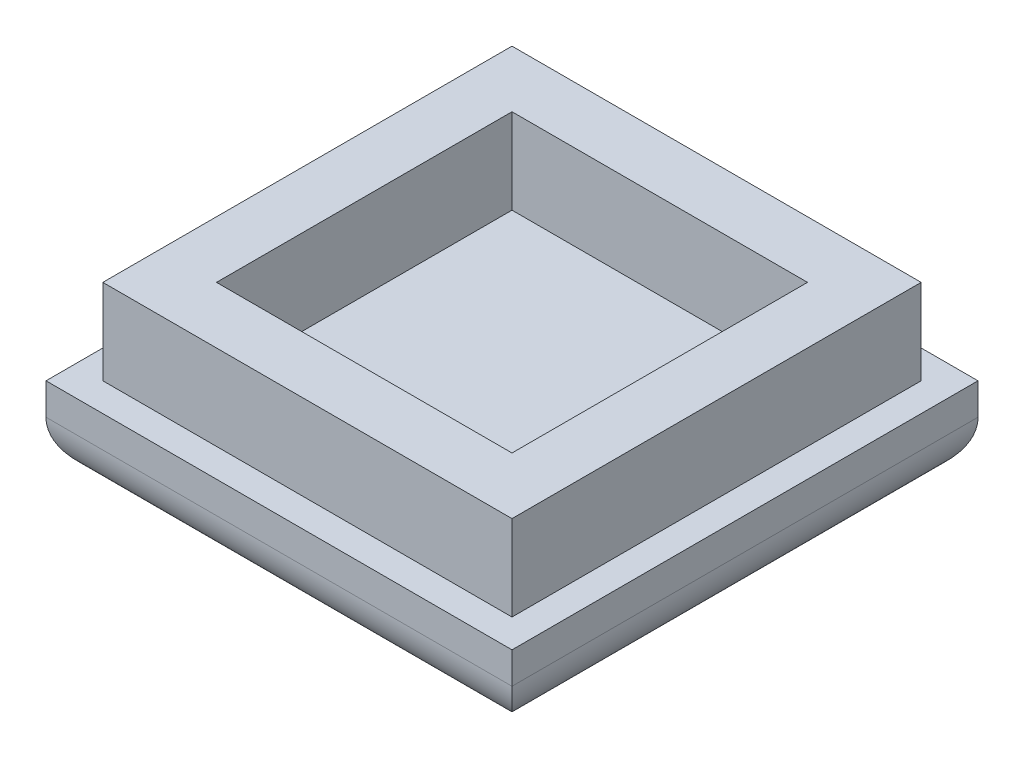
from build123d import *

# Parameters (mm, degrees)
SKETCH1_W                = 22.86
SKETCH1_H                = 22.86
SKETCH1_W_2              = 16.51
SKETCH1_H_2              = 16.51
BOSS_EXTRUDE1_DEPTH      = 6.35
BOSS_EXTRUDE2_DEPTH      = 1.5875
BOSS_EXTRUDE2_DEPTH_BACK = 3.175
SKETCH1_3_W              = 26.035
SKETCH1_3_H              = 26.035
FILLET1_R                = 3
CUT_EXTRUDE1_DEPTH       = 1


with BuildPart() as part:
    # Sketch1 → Boss-Extrude1 (new body)
    with BuildSketch(Plane(origin=(0, 0, 0), x_dir=(1, 0, 0), z_dir=(0, 1, 0))):
        with Locations((-52.595020858, 17.564583421)):
            Rectangle(SKETCH1_W, SKETCH1_H)
        with Locations((-52.595020858, 17.564583421)):
            Rectangle(SKETCH1_W_2, SKETCH1_H_2, mode=Mode.SUBTRACT)
    extrude(amount=BOSS_EXTRUDE1_DEPTH)

    # Sketch1<3> → Boss-Extrude2 (add, two sides: drawn at the far end of the back side and taken through both)
    with BuildSketch(Plane(origin=(0, 0, 0), x_dir=(1, 0, 0), z_dir=(0, 1, 0)).offset(-BOSS_EXTRUDE2_DEPTH_BACK)):
        with Locations((-52.595020858, 17.564583421)):
            Rectangle(SKETCH1_3_W, SKETCH1_3_H)
    extrude(amount=BOSS_EXTRUDE2_DEPTH + BOSS_EXTRUDE2_DEPTH_BACK)

    # Fillet1
    fillet1_edges = [part.edges().sort_by_distance(p)[0] for p in [
        (-52.595020858, -3.175, -30.582083421),
        (-39.577520858, -3.175, -17.564583421),
        (-52.595020858, -3.175, -4.547083421),
        (-65.612520858, -3.175, -17.564583421),
    ]]
    fillet(fillet1_edges, radius=FILLET1_R)

    # Sketch2 → Cut-Extrude1 (cut)
    # profile 1 of 11: a face of its own
    with BuildSketch(Plane(origin=(0, -3.175, 0), x_dir=(-1, 0, 0), z_dir=(0, -1, 0))):
        Polygon((58.842157984, 26.640147671), (59.271218345, 27.069208032), (61.751201751, 24.589224626), (61.32214139, 24.160164265), (60.266551264, 25.215754391), (59.778685676, 24.727888803), (60.834275802, 23.672298677), (60.396503556, 23.23452643), (57.91652015, 25.714509836), (58.354292396, 26.152282083), (59.422950351, 25.083624128), (59.910815939, 25.571489716), align=None)
    # profile 2 of 11: a face of its own
    with BuildSketch(Plane(origin=(0, -3.175, 0), x_dir=(-1, 0, 0), z_dir=(0, -1, 0))):
        with BuildLine():
            Line((59.665433681, 22.503456555), (57.759708727, 24.409181508))
            add(Edge.make_bspline(
                [(57.759708727, 24.409181508), (57.738522026, 24.429251315), (57.699131078, 24.466565698), (57.635567911, 24.508369583), (57.573636035, 24.532874055), (57.513228744, 24.538097721), (57.455910348, 24.527659249), (57.400357879, 24.506176439), (57.346724247, 24.471974802), (57.314698871, 24.442167384), (57.297978796, 24.426605279)],
                knots=[0, 0, 0, 0, 1.316322234, 2.447345534, 3.41587546, 4.293733729, 5.147368164, 6.026382719, 6.969597433, 8, 8, 8, 8], degree=3))
            add(Edge.make_bspline(
                [(57.297978796, 24.426605279), (57.282321332, 24.409938788), (57.25241913, 24.378109571), (57.219460584, 24.323829793), (57.196668497, 24.268865963), (57.1866132, 24.211349206), (57.191465978, 24.150773626), (57.217279431, 24.08940919), (57.257797996, 24.025185013), (57.295224163, 23.986001324), (57.315402567, 23.964875348)],
                knots=[0, 0, 0, 0, 1.030889829, 1.968765676, 2.852199039, 3.706237146, 4.584510541, 5.557378995, 6.683055297, 8, 8, 8, 8], degree=3))
            Line((57.315402567, 23.964875348), (59.22112752, 22.059150394))
            Line((59.22112752, 22.059150394), (58.815298854, 21.653321728))
            Line((58.815298854, 21.653321728), (56.934983567, 23.533637016))
            add(Edge.make_bspline(
                [(56.934983567, 23.533637016), (56.911160792, 23.558483674), (56.864943864, 23.606686969), (56.803204477, 23.682376935), (56.752390007, 23.759878777), (56.709970234, 23.837418548), (56.676653613, 23.9158474), (56.653460368, 23.995053017), (56.639299961, 24.075165003), (56.635108957, 24.155823257), (56.639877884, 24.236817258), (56.655838155, 24.317560768), (56.680341386, 24.398312038), (56.71559204, 24.478618238), (56.761491, 24.558041911), (56.815845463, 24.63782822), (56.880124708, 24.717537318), (56.928766057, 24.767949596), (56.953859319, 24.793956451)],
                knots=[0, 0, 0, 0, 1.14727371, 2.225746903, 3.250503492, 4.232351556, 5.168772348, 6.085207589, 6.977791315, 7.874557658, 8.771795591, 9.675213844, 10.611738878, 11.579937216, 12.591558839, 13.665587569, 14.795715502, 16, 16, 16, 16], degree=3))
            add(Edge.make_bspline(
                [(56.953859319, 24.793956451), (56.979867703, 24.819049546), (57.030527961, 24.867926964), (57.11035543, 24.93226413), (57.190014187, 24.987410165), (57.269603463, 25.032988703), (57.350537126, 25.067101558), (57.430820983, 25.092964038), (57.51174788, 25.108592104), (57.59271226, 25.113451969), (57.67337842, 25.109236696), (57.753488286, 25.095082796), (57.832694487, 25.071887758), (57.911123176, 25.038571637), (57.988662994, 24.996151721), (58.066164823, 24.945337292), (58.141854792, 24.883597894), (58.190058087, 24.837380967), (58.214904745, 24.813558194)],
                knots=[0, 0, 0, 0, 1.203464209, 2.344159745, 3.410805776, 4.428753563, 5.393096494, 6.331376355, 7.234179251, 8.130806038, 9.026961555, 9.918937304, 10.834748322, 11.770531278, 12.751710564, 13.775769147, 14.853507747, 16, 16, 16, 16], degree=3))
            Line((58.214904745, 24.813558194), (60.095220032, 22.933242906))
            Line((60.095220032, 22.933242906), (59.665433681, 22.503456555))
        make_face()
    # profile 3 of 11: a face of its own
    with BuildSketch(Plane(origin=(0, -3.175, 0), x_dir=(-1, 0, 0), z_dir=(0, -1, 0))):
        with BuildLine():
            Line((56.801417876, 21.811604202), (56.200297777, 21.210484103))
            Line((56.200297777, 21.210484103), (55.411146149, 21.999635731))
            add(Edge.make_bspline(
                [(55.411146149, 21.999635731), (55.387279592, 22.024448595), (55.340611027, 22.072967566), (55.279105598, 22.149683326), (55.226941523, 22.227425926), (55.183770034, 22.30541725), (55.151067367, 22.384721367), (55.126283916, 22.464025644), (55.112980238, 22.544611167), (55.107261516, 22.625429146), (55.112811338, 22.706589857), (55.127252939, 22.787783753), (55.152323061, 22.868868402), (55.187535663, 22.949446662), (55.232007469, 23.029850176), (55.287437984, 23.109224557), (55.351673648, 23.189106049), (55.400565469, 23.239758642), (55.425665958, 23.265763091)],
                knots=[0, 0, 0, 0, 1.142074728, 2.233208173, 3.257768271, 4.246059396, 5.185644489, 6.100221424, 6.99667273, 7.889844743, 8.783016756, 9.688772054, 10.621053134, 11.592229698, 12.602336328, 13.664872487, 14.801172834, 16, 16, 16, 16], degree=3))
            add(Edge.make_bspline(
                [(55.425665958, 23.265763091), (55.451672812, 23.290856352), (55.502085091, 23.339497701), (55.58179419, 23.403776947), (55.661580496, 23.458131402), (55.74100418, 23.504030391), (55.821310342, 23.539280947), (55.902061744, 23.563784524), (55.982804781, 23.57974356), (56.063800521, 23.584517032), (56.144452307, 23.580309118), (56.224588537, 23.566212088), (56.303611474, 23.542801089), (56.382322813, 23.510484415), (56.459910882, 23.46828699), (56.536159097, 23.415759718), (56.613147021, 23.356008996), (56.660781243, 23.309344614), (56.685259403, 23.285364833)],
                knots=[0, 0, 0, 0, 1.205033327, 2.335863978, 3.410560543, 4.422811197, 5.391611565, 6.328718934, 7.232698936, 8.130494776, 9.027818731, 9.92095747, 10.837962553, 11.771865889, 12.75432447, 13.777491696, 14.857902762, 16, 16, 16, 16], degree=3))
            Line((56.685259403, 23.285364833), (57.967358553, 22.003265683))
            add(Edge.make_bspline(
                [(57.967358553, 22.003265683), (57.991338333, 21.978787523), (58.038002716, 21.931153301), (58.097753437, 21.854165377), (58.15028071, 21.777917162), (58.192478134, 21.700329093), (58.224794808, 21.621617754), (58.248205808, 21.542594817), (58.262302838, 21.462458588), (58.266510751, 21.381806801), (58.261737279, 21.300811062), (58.245778244, 21.220068024), (58.221274667, 21.139316623), (58.18602411, 21.05901046), (58.140125122, 20.979586776), (58.085770667, 20.89980047), (58.02149142, 20.820091371), (57.972850072, 20.769679093), (57.94775681, 20.743672238)],
                knots=[0, 0, 0, 0, 1.142097238, 2.222508304, 3.24567553, 4.228134111, 5.162037447, 6.07904253, 6.972181269, 7.869505224, 8.767301064, 9.671281066, 10.608388435, 11.577188803, 12.589439457, 13.664136022, 14.794966673, 16, 16, 16, 16], degree=3))
            add(Edge.make_bspline(
                [(57.94775681, 20.743672238), (57.921705343, 20.718633505), (57.871096588, 20.669992133), (57.791865771, 20.60488549), (57.71183515, 20.55057381), (57.632266698, 20.504757102), (57.552336334, 20.468943057), (57.471791448, 20.443013954), (57.391024115, 20.427901354), (57.310421843, 20.42198729), (57.230369542, 20.425260005), (57.151133793, 20.439846229), (57.072392271, 20.46220141), (56.994469711, 20.494366123), (56.917673827, 20.53649175), (56.841721812, 20.587339956), (56.766023127, 20.647389191), (56.718520131, 20.693157967), (56.693971289, 20.716810591)],
                knots=[0, 0, 0, 0, 1.21022765, 2.351042799, 3.430371867, 4.44698585, 5.423232885, 6.359057276, 7.27489836, 8.169024841, 9.061716805, 9.950719944, 10.861631989, 11.799560936, 12.7681367, 13.79119521, 14.858522515, 16, 16, 16, 16], degree=3))
            Line((56.693971289, 20.716810591), (56.456572409, 20.954209471))
            Line((56.456572409, 20.954209471), (56.862401075, 21.360038137))
            Line((56.862401075, 21.360038137), (57.120127688, 21.102311524))
            add(Edge.make_bspline(
                [(57.120127688, 21.102311524), (57.141083072, 21.082721759), (57.179870226, 21.046462281), (57.242752236, 21.005843366), (57.304020253, 20.981496381), (57.364412105, 20.97634534), (57.422130978, 20.986635523), (57.477468303, 21.009066667), (57.531900942, 21.042257496), (57.563736058, 21.072142997), (57.580405638, 21.087791715)],
                knots=[0, 0, 0, 0, 1.300892313, 2.407873352, 3.381818771, 4.264585546, 5.122993041, 6.02116182, 6.963835982, 8, 8, 8, 8], degree=3))
            add(Edge.make_bspline(
                [(57.580405638, 21.087791715), (57.595757859, 21.104504601), (57.625174809, 21.136528771), (57.658361203, 21.190390197), (57.68034951, 21.245836434), (57.689672846, 21.303909877), (57.683588605, 21.364818024), (57.659355428, 21.42753634), (57.617680959, 21.491764322), (57.580175094, 21.53126143), (57.560077905, 21.552425609)],
                knots=[0, 0, 0, 0, 1.019744547, 1.953969752, 2.829976834, 3.689710769, 4.576423019, 5.551852122, 6.688181448, 8, 8, 8, 8], degree=3))
            Line((57.560077905, 21.552425609), (56.230789376, 22.881714138))
            add(Edge.make_bspline(
                [(56.230789376, 22.881714138), (56.209651621, 22.901861382), (56.170446084, 22.939229754), (56.106434151, 22.980070723), (56.044730389, 23.00473247), (55.984329256, 23.009834491), (55.926811959, 22.999679079), (55.871954625, 22.977130937), (55.818200304, 22.943715029), (55.786475847, 22.914029591), (55.769785435, 22.898411919)],
                knots=[0, 0, 0, 0, 1.319116741, 2.446649622, 3.417235704, 4.296957636, 5.152404308, 6.037294719, 6.967409923, 8, 8, 8, 8], degree=3))
            add(Edge.make_bspline(
                [(55.769785435, 22.898411919), (55.754137648, 22.881742525), (55.724253924, 22.849907766), (55.691050873, 22.795472673), (55.668572597, 22.73992172), (55.658153423, 22.681889848), (55.664401174, 22.620989731), (55.689592951, 22.558847894), (55.731165684, 22.494117), (55.76900283, 22.454431931), (55.789387177, 22.433052035)],
                knots=[0, 0, 0, 0, 1.022870966, 1.953451467, 2.84009755, 3.698194483, 4.570649028, 5.546082863, 6.677979014, 8, 8, 8, 8], degree=3))
            Line((55.789387177, 22.433052035), (56.250391118, 21.972048094))
            Line((56.250391118, 21.972048094), (56.445682552, 22.167339527))
            Line((56.445682552, 22.167339527), (56.801417876, 21.811604202))
        make_face()
    # profile 4 of 11: a face of its own
    with BuildSketch(Plane(origin=(0, -3.175, 0), x_dir=(-1, 0, 0), z_dir=(0, -1, 0))):
        with BuildLine():
            add(Edge.make_bspline(
                [(56.475649722, 20.511556853), (56.499621828, 20.487074409), (56.546271274, 20.439431851), (56.606127519, 20.362502821), (56.658229776, 20.286126476), (56.701732882, 20.209271122), (56.734162705, 20.131031354), (56.758923083, 20.052696566), (56.773310377, 19.973438458), (56.77857668, 19.893755108), (56.773936917, 19.813865467), (56.760589995, 19.733670683), (56.734966361, 19.654100144), (56.700599725, 19.574269502), (56.656080475, 19.494679094), (56.601884106, 19.414847547), (56.536987098, 19.335885367), (56.488346314, 19.285275402), (56.463307884, 19.259223312)],
                knots=[0, 0, 0, 0, 1.147548425, 2.233116251, 3.261167015, 4.245110883, 5.186586225, 6.094772243, 6.993602212, 7.879494458, 8.764903899, 9.670296887, 10.596379033, 11.559134903, 12.579316873, 13.647874652, 14.789215095, 16, 16, 16, 16], degree=3))
            add(Edge.make_bspline(
                [(56.463307884, 19.259223312), (56.437316322, 19.234105098), (56.386933688, 19.185415382), (56.307172225, 19.121601046), (56.228483919, 19.066292727), (56.148386039, 19.022962631), (56.069328516, 18.986873993), (55.989028884, 18.963433986), (55.909043489, 18.948133234), (55.828993903, 18.944069022), (55.749099211, 18.949185432), (55.669832867, 18.96361775), (55.591500335, 18.988365795), (55.513259933, 19.020799083), (55.43640476, 19.0643012), (55.360028363, 19.11640374), (55.283099348, 19.176259904), (55.235456788, 19.222909362), (55.210974343, 19.246881474)],
                knots=[0, 0, 0, 0, 1.210890748, 2.347218136, 3.420446406, 4.429694985, 5.395775476, 6.327322056, 7.226230598, 8.119816741, 9.005786429, 9.904694971, 10.812960379, 11.754518023, 12.738547904, 13.766688536, 14.85235126, 16, 16, 16, 16], degree=3))
            Line((55.210974343, 19.246881474), (55.133293364, 19.324562453))
            Line((55.133293364, 19.324562453), (55.539848021, 19.73111711))
            Line((55.539848021, 19.73111711), (55.640760695, 19.630204436))
            add(Edge.make_bspline(
                [(55.640760695, 19.630204436), (55.661968984, 19.610148503), (55.701104887, 19.573139057), (55.764044716, 19.531297673), (55.824119631, 19.504602451), (55.883320466, 19.496962019), (55.939635883, 19.505091657), (55.99444326, 19.525079556), (56.04726104, 19.558921071), (56.079205879, 19.588062154), (56.095956712, 19.603342789)],
                knots=[0, 0, 0, 0, 1.333215265, 2.460197613, 3.443029833, 4.313694693, 5.151424605, 6.02356654, 6.963622678, 8, 8, 8, 8], degree=3))
            add(Edge.make_bspline(
                [(56.095956712, 19.603342789), (56.111237686, 19.620093496), (56.140379416, 19.652038096), (56.174216529, 19.704857507), (56.194302321, 19.759886297), (56.202338876, 19.816480447), (56.194580487, 19.876085093), (56.168118061, 19.936893994), (56.125550402, 20.000057656), (56.088384811, 20.039483675), (56.068369075, 20.060716778)],
                knots=[0, 0, 0, 0, 1.031663454, 1.967443832, 2.835618909, 3.680464448, 4.547169169, 5.535721002, 6.672848743, 8, 8, 8, 8], degree=3))
            add(Edge.make_bspline(
                [(56.068369075, 20.060716778), (56.047181831, 20.080816127), (56.005790905, 20.120081766), (55.934716156, 20.165519503), (55.8610311, 20.201764068), (55.782220956, 20.223222107), (55.701158982, 20.237273072), (55.61752646, 20.246991034), (55.531155263, 20.250382357), (55.411713041, 20.247687112), (55.257658646, 20.238159421), (55.068861861, 20.218915292), (54.8756364, 20.203303975), (54.712706791, 20.203239627), (54.582582737, 20.213449727), (54.485123454, 20.228447664), (54.388413224, 20.252565475), (54.291212003, 20.281269174), (54.195313423, 20.322137432), (54.101763489, 20.376811121), (54.009713496, 20.444191244), (53.953441795, 20.498277429), (53.924519251, 20.526076662)],
                knots=[0, 0, 0, 0, 0.766999624, 1.498393328, 2.210677015, 2.920249948, 3.638658968, 4.375826668, 5.134476084, 5.911669889, 7.519646407, 9.19546478, 10.906798196, 12.62022845, 13.476623857, 14.34056599, 15.211896375, 16.098390702, 17.005849835, 17.947601136, 18.945107461, 20, 20, 20, 20], degree=3))
            add(Edge.make_bspline(
                [(53.924519251, 20.526076662), (53.900531939, 20.550550941), (53.853852902, 20.598177611), (53.79420572, 20.675218893), (53.741379789, 20.751185268), (53.700447178, 20.829399031), (53.667016447, 20.907324895), (53.643495605, 20.986482766), (53.62976639, 21.066407581), (53.625061733, 21.14708669), (53.631234154, 21.227993801), (53.646519556, 21.308852138), (53.671499426, 21.389501599), (53.706739408, 21.469749432), (53.75228752, 21.549616291), (53.806806095, 21.629766833), (53.871887426, 21.709013236), (53.920532391, 21.759619779), (53.945572974, 21.785670107)],
                knots=[0, 0, 0, 0, 1.141790321, 2.221911046, 3.244803314, 4.223177839, 5.159929099, 6.068947343, 6.969797301, 7.858821942, 8.756920543, 9.668585759, 10.597728123, 11.566268144, 12.585269254, 13.659677015, 14.795290504, 16, 16, 16, 16], degree=3))
            add(Edge.make_bspline(
                [(53.945572974, 21.785670107), (53.971579829, 21.810763369), (54.021992107, 21.859404717), (54.101701206, 21.923683964), (54.181487513, 21.978038419), (54.260911196, 22.023937407), (54.341217359, 22.059187964), (54.421968761, 22.08369154), (54.502711798, 22.099650576), (54.583707537, 22.104424048), (54.664359324, 22.100216135), (54.744495553, 22.086119105), (54.823518491, 22.062708105), (54.90222983, 22.030391431), (54.979817899, 21.988194007), (55.056066114, 21.935666734), (55.133054037, 21.875916012), (55.18068826, 21.82925163), (55.20516642, 21.805271849)],
                knots=[0, 0, 0, 0, 1.205033327, 2.335863978, 3.410560543, 4.422811197, 5.391611565, 6.328718934, 7.232698936, 8.130494776, 9.027818731, 9.92095747, 10.837962553, 11.771865889, 12.75432447, 13.777491696, 14.857902762, 16, 16, 16, 16], degree=3))
            Line((55.20516642, 21.805271849), (55.356898425, 21.653539844))
            Line((55.356898425, 21.653539844), (54.951069759, 21.247711177))
            Line((54.951069759, 21.247711177), (54.774654078, 21.424126859))
            add(Edge.make_bspline(
                [(54.774654078, 21.424126859), (54.753467376, 21.444196666), (54.714076429, 21.481511048), (54.650513261, 21.523314933), (54.588581385, 21.547819405), (54.528174095, 21.553043072), (54.470855698, 21.5426046), (54.415303229, 21.521121789), (54.361669597, 21.486920152), (54.329644221, 21.457112735), (54.312924146, 21.44155063)],
                knots=[0, 0, 0, 0, 1.316322234, 2.447345534, 3.41587546, 4.293733729, 5.147368164, 6.026382719, 6.969597433, 8, 8, 8, 8], degree=3))
            add(Edge.make_bspline(
                [(54.312924146, 21.44155063), (54.297377131, 21.424826067), (54.267598617, 21.392792095), (54.233075646, 21.33902578), (54.212247437, 21.282986968), (54.200473619, 21.225696653), (54.205792686, 21.164967083), (54.231463848, 21.103636981), (54.272028461, 21.039401694), (54.309447413, 21.000219745), (54.329621927, 20.979094708)],
                knots=[0, 0, 0, 0, 1.029104365, 1.971130724, 2.859229501, 3.713673788, 4.590426046, 5.561609527, 6.685336198, 8, 8, 8, 8], degree=3))
            add(Edge.make_bspline(
                [(54.329621927, 20.979094708), (54.350899618, 20.959369432), (54.392677431, 20.920639718), (54.462805605, 20.873915987), (54.537329297, 20.83922633), (54.615593962, 20.81628115), (54.696861923, 20.80264122), (54.780456864, 20.792736042), (54.866832263, 20.789669402), (54.986527724, 20.790822988), (55.140817255, 20.801119085), (55.329853655, 20.820028741), (55.522847483, 20.836108546), (55.685749043, 20.834873924), (55.815917615, 20.825066661), (55.913457913, 20.809595251), (56.010570478, 20.787005375), (56.107522662, 20.756641435), (56.203968268, 20.716472506), (56.297920165, 20.661598875), (56.389556842, 20.593179234), (56.446416017, 20.539272555), (56.475649722, 20.511556853)],
                knots=[0, 0, 0, 0, 0.762041063, 1.496234184, 2.205117161, 2.9157972, 3.633507671, 4.369958582, 5.127870322, 5.904230187, 7.516995374, 9.191184257, 10.90085365, 12.60629011, 13.468195013, 14.331297088, 15.200313692, 16.08784146, 17.000272837, 17.941108422, 18.941436834, 20, 20, 20, 20], degree=3))
        make_face()
    # profile 5 of 11: a face of its own
    with BuildSketch(Plane(origin=(0, -3.175, 0), x_dir=(-1, 0, 0), z_dir=(0, -1, 0))):
        Polygon((51.705012004, 19.503001691), (52.138428308, 19.936417994), (52.646621629, 19.576326727), (53.173690702, 20.1033958), (52.813599434, 20.611589121), (53.207812253, 21.00580194), (55.250749403, 18.088772278), (54.622041666, 17.460064541), align=None)
        Polygon((53.474250752, 19.6924852), (53.061162181, 19.279396629), (54.508787155, 18.245586217), align=None, mode=Mode.SUBTRACT)
    # profile 6 of 11: a face of its own
    with BuildSketch(Plane(origin=(0, -3.175, 0), x_dir=(-1, 0, 0), z_dir=(0, -1, 0))):
        Polygon((53.997521419, 16.835544294), (53.568461058, 16.406483933), (51.444212977, 18.530732014), (50.737824261, 17.824343298), (50.382088936, 18.180078623), (51.517538013, 19.3155277), align=None)
    # profile 7 of 11: a face of its own
    with BuildSketch(Plane(origin=(0, -3.175, 0), x_dir=(-1, 0, 0), z_dir=(0, -1, 0))):
        with BuildLine():
            add(Edge.make_bspline(
                [(52.119243726, 16.155150857), (52.14277603, 16.130262562), (52.188535746, 16.081866057), (52.250560389, 16.006343773), (52.300865973, 15.928418255), (52.343445161, 15.850477045), (52.374096579, 15.770893654), (52.39775315, 15.690962351), (52.409645275, 15.609611162), (52.412617386, 15.527572584), (52.406364821, 15.445345292), (52.388858288, 15.36352921), (52.36374933, 15.281734101), (52.327730051, 15.200715099), (52.281235477, 15.120901091), (52.226614678, 15.040484662), (52.161954256, 14.960639853), (52.11310485, 14.909960005), (52.088026136, 14.883941564)],
                knots=[0, 0, 0, 0, 1.133852916, 2.204832379, 3.229163016, 4.20039659, 5.13910311, 6.046946421, 6.954471556, 7.852291783, 8.760417823, 9.676389819, 10.616428588, 11.58845479, 12.603975983, 13.670541865, 14.804083426, 16, 16, 16, 16], degree=3))
            add(Edge.make_bspline(
                [(52.088026136, 14.883941564), (52.062025934, 14.85883408), (52.011381614, 14.809928636), (51.931179019, 14.745578126), (51.851442802, 14.689455589), (51.770220041, 14.644805852), (51.689745586, 14.60722509), (51.607676086, 14.582461019), (51.525904542, 14.564850522), (51.443672279, 14.558653358), (51.361849626, 14.561498601), (51.280601304, 14.573771048), (51.20033905, 14.596733118), (51.121180501, 14.62893375), (51.042657452, 14.669894137), (50.965531767, 14.721246244), (50.889378484, 14.782393926), (50.840933649, 14.828403833), (50.816090853, 14.851997984)],
                knots=[0, 0, 0, 0, 1.195214994, 2.328091568, 3.398562519, 4.416515147, 5.391231983, 6.330719282, 7.246153927, 8.153747219, 9.051040742, 9.950118506, 10.865132905, 11.80625635, 12.773181664, 13.790220779, 14.866812255, 16, 16, 16, 16], degree=3))
            Line((50.816090853, 14.851997984), (49.533991704, 16.134097133))
            add(Edge.make_bspline(
                [(49.533991704, 16.134097133), (49.510397553, 16.158939929), (49.464387645, 16.207384764), (49.403239964, 16.283538047), (49.351887856, 16.360663732), (49.31092747, 16.439186782), (49.278726838, 16.51834533), (49.255764767, 16.598607584), (49.243492321, 16.679855906), (49.240647078, 16.76167856), (49.246844242, 16.843910823), (49.264454739, 16.925682366), (49.28921881, 17.007751866), (49.326799572, 17.088226322), (49.371449309, 17.169449083), (49.427571846, 17.2491853), (49.491922355, 17.329387894), (49.5408278, 17.380032214), (49.565935284, 17.406032417)],
                knots=[0, 0, 0, 0, 1.133187745, 2.209779221, 3.226818336, 4.19374365, 5.134867095, 6.049881494, 6.948959258, 7.846252781, 8.753846073, 9.669280718, 10.608768017, 11.583484853, 12.601437481, 13.671908432, 14.804785006, 16, 16, 16, 16], degree=3))
            add(Edge.make_bspline(
                [(49.565935284, 17.406032417), (49.591953725, 17.43111113), (49.642633573, 17.479960536), (49.722478382, 17.544620959), (49.80289481, 17.599241758), (49.882708819, 17.645736331), (49.963727821, 17.681755611), (50.04552293, 17.706864568), (50.127339012, 17.724371102), (50.209566304, 17.730623666), (50.291604882, 17.727651555), (50.372956071, 17.715759431), (50.452887373, 17.692102859), (50.532470765, 17.661451442), (50.610411975, 17.618872254), (50.688337493, 17.568566669), (50.763859777, 17.506542026), (50.812256282, 17.460782311), (50.837144576, 17.437250006)],
                knots=[0, 0, 0, 0, 1.195916574, 2.329458135, 3.396024017, 4.41154521, 5.383571412, 6.323610181, 7.239582177, 8.147708217, 9.045528444, 9.953053579, 10.86089689, 11.79960341, 12.770836984, 13.795167621, 14.866147084, 16, 16, 16, 16], degree=3))
            Line((50.837144576, 17.437250006), (52.119243726, 16.155150857))
        make_face()
        with BuildLine():
            add(Edge.make_bspline(
                [(50.386304502, 17.029969359), (50.365140323, 17.050066548), (50.325643215, 17.087572413), (50.261415233, 17.129246882), (50.198696917, 17.153480058), (50.13778877, 17.1595643), (50.079715327, 17.150240963), (50.02426909, 17.128252656), (49.970407664, 17.095066263), (49.938383494, 17.065649312), (49.921670608, 17.050297092)],
                knots=[0, 0, 0, 0, 1.311818552, 2.448147878, 3.423576981, 4.310289231, 5.170023166, 6.046030248, 6.980255453, 8, 8, 8, 8], degree=3))
            add(Edge.make_bspline(
                [(49.921670608, 17.050297092), (49.906008081, 17.033641293), (49.875954497, 17.001681799), (49.842932809, 16.946926015), (49.821335092, 16.890924761), (49.810741034, 16.832839134), (49.816810923, 16.771837123), (49.842414839, 16.709850878), (49.883561498, 16.645553367), (49.921137552, 16.606085642), (49.941272351, 16.584937208)],
                knots=[0, 0, 0, 0, 1.024064859, 1.964997057, 2.848746829, 3.707845332, 4.592129172, 5.558556785, 6.691774083, 8, 8, 8, 8], degree=3))
            Line((49.941272351, 16.584937208), (51.267656918, 15.258552641))
            add(Edge.make_bspline(
                [(51.267656918, 15.258552641), (51.288783764, 15.238384868), (51.327969068, 15.200978418), (51.392182944, 15.160334011), (51.453824722, 15.134807744), (51.51483438, 15.128749673), (51.572918065, 15.13934073), (51.628919855, 15.160939275), (51.683675485, 15.193960725), (51.715635002, 15.224014344), (51.732290812, 15.239676889)],
                knots=[0, 0, 0, 0, 1.310682381, 2.431005878, 3.399248158, 4.285192424, 5.145904061, 6.031313255, 6.974012248, 8, 8, 8, 8], degree=3))
            add(Edge.make_bspline(
                [(51.732290812, 15.239676889), (51.747645306, 15.256390102), (51.777066613, 15.288414899), (51.810223042, 15.34227201), (51.832315711, 15.397733276), (51.841253722, 15.455729504), (51.836686058, 15.516918395), (51.810996766, 15.57889575), (51.770273568, 15.643263467), (51.732860442, 15.682454731), (51.712689069, 15.703584792)],
                knots=[0, 0, 0, 0, 1.021303817, 1.956957526, 2.834304093, 3.695352629, 4.582414803, 5.563166371, 6.686175574, 8, 8, 8, 8], degree=3))
            Line((51.712689069, 15.703584792), (50.386304502, 17.029969359))
        make_face(mode=Mode.SUBTRACT)
    # profile 8 of 11: a face of its own
    with BuildSketch(Plane(origin=(0, -3.175, 0), x_dir=(-1, 0, 0), z_dir=(0, -1, 0))):
        Polygon((51.26404352, 14.102066394), (49.936932962, 12.774955836), (49.581197638, 13.130691161), (50.029859741, 13.579353264), (47.905611659, 15.703601346), (48.335398011, 16.133387697), (50.459646092, 14.009139616), (50.908308195, 14.457801719), align=None)
    # profile 9 of 11: a face of its own
    with BuildSketch(Plane(origin=(0, -3.175, 0), x_dir=(-1, 0, 0), z_dir=(0, -1, 0))):
        with BuildLine():
            add(Edge.make_bspline(
                [(49.11169741, 11.949720284), (49.084242933, 11.922927487), (49.031320063, 11.87128011), (48.948524205, 11.803107048), (48.868479248, 11.743564921), (48.788667459, 11.695652687), (48.711011607, 11.656137451), (48.633807195, 11.628657821), (48.558123522, 11.610608827), (48.483606457, 11.603080017), (48.409732031, 11.606533375), (48.336269603, 11.617868341), (48.262972482, 11.639424863), (48.190008436, 11.670255365), (48.117444875, 11.710433474), (48.045106961, 11.759868123), (47.972310694, 11.81763201), (47.926501924, 11.862178319), (47.902923297, 11.885107133)],
                knots=[0, 0, 0, 0, 1.318336109, 2.541302495, 3.684605597, 4.744811653, 5.738308951, 6.675217091, 7.55516179, 8.407898072, 9.240590362, 10.091416727, 10.957724193, 11.860157037, 12.809725432, 13.804336985, 14.86985135, 16, 16, 16, 16], degree=3))
            Line((47.902923297, 11.885107133), (47.814352461, 11.973677969))
            add(Edge.make_bspline(
                [(47.814352461, 11.973677969), (47.78465611, 12.005046787), (47.727592415, 12.065324248), (47.655950743, 12.161219375), (47.601113108, 12.257510094), (47.562308217, 12.35401462), (47.541100713, 12.452272417), (47.539455528, 12.551849449), (47.554419246, 12.653313857), (47.578393122, 12.718399596), (47.590747399, 12.751939741)],
                knots=[0, 0, 0, 0, 1.19723081, 2.300565967, 3.310306842, 4.262446848, 5.174603053, 6.080839401, 7.011013375, 8, 8, 8, 8], degree=3))
            add(Edge.make_bspline(
                [(47.590747399, 12.751939741), (47.571286983, 12.742883567), (47.533425333, 12.725264124), (47.475472814, 12.705132711), (47.418899211, 12.689177609), (47.362549764, 12.680811423), (47.307197098, 12.677127249), (47.2523786, 12.678086211), (47.19868307, 12.686513485), (47.127554147, 12.704265552), (47.040085631, 12.739618421), (46.937157529, 12.797121473), (46.836048645, 12.871667564), (46.77315092, 12.93103759), (46.740612573, 12.961750983)],
                knots=[0, 0, 0, 0, 0.816697949, 1.58894499, 2.333202708, 3.051219712, 3.752973105, 4.444244702, 5.133548612, 5.81735012, 7.23233249, 8.708937778, 10.297462654, 12, 12, 12, 12], degree=3))
            Line((46.740612573, 12.961750983), (46.538787225, 13.163576331))
            add(Edge.make_bspline(
                [(46.538787225, 13.163576331), (46.516126937, 13.187175816), (46.472098743, 13.233028841), (46.414269633, 13.306030171), (46.366382689, 13.380416479), (46.326366242, 13.45505858), (46.297537231, 13.531360978), (46.276372529, 13.607814466), (46.266637518, 13.685746717), (46.264948002, 13.764146077), (46.272925016, 13.843462725), (46.291692667, 13.922939466), (46.319019853, 14.003032747), (46.357741539, 14.082592969), (46.405167693, 14.162663423), (46.462049632, 14.243165874), (46.528212129, 14.324272704), (46.578299886, 14.375633278), (46.604126367, 14.402116053)],
                knots=[0, 0, 0, 0, 1.107368409, 2.151580398, 3.147044195, 4.099952097, 5.012957072, 5.903364661, 6.779443922, 7.664519794, 8.554022114, 9.470330168, 10.423907161, 11.413452069, 12.460360957, 13.571965217, 14.748045538, 16, 16, 16, 16], degree=3))
            Line((46.604126367, 14.402116053), (47.279297493, 15.077287179))
            Line((47.279297493, 15.077287179), (49.759280899, 12.597303773))
            Line((49.759280899, 12.597303773), (49.11169741, 11.949720284))
        make_face()
        with BuildLine():
            Line((47.965358476, 13.533105474), (47.205972457, 14.292491494))
            Line((47.205972457, 14.292491494), (46.959861691, 14.046380728))
            add(Edge.make_bspline(
                [(46.959861691, 14.046380728), (46.943257315, 14.028746707), (46.911713262, 13.995246593), (46.87650791, 13.939528078), (46.853580946, 13.883854337), (46.843654977, 13.826796981), (46.851924802, 13.767103711), (46.878322721, 13.705962844), (46.922001792, 13.641854263), (46.960162606, 13.601509408), (46.980915414, 13.579568863)],
                knots=[0, 0, 0, 0, 1.072721915, 2.03789634, 2.905238353, 3.731392293, 4.57576632, 5.538848061, 6.66156377, 8, 8, 8, 8], degree=3))
            Line((46.980915414, 13.579568863), (47.19580859, 13.364675688))
            add(Edge.make_bspline(
                [(47.19580859, 13.364675688), (47.209902193, 13.35092055), (47.236906659, 13.32456461), (47.278569653, 13.289957191), (47.317875357, 13.259534031), (47.356153638, 13.234822385), (47.393271808, 13.215575773), (47.429187155, 13.202367637), (47.463541668, 13.194151647), (47.508206236, 13.189786843), (47.565811571, 13.200322574), (47.634921472, 13.229839254), (47.706080614, 13.277567302), (47.750121614, 13.319172506), (47.773696995, 13.341443993)],
                knots=[0, 0, 0, 0, 1.046844211, 2.005836963, 2.878383783, 3.688734618, 4.425432988, 5.097224855, 5.718421997, 6.29981927, 7.471976471, 8.781666365, 10.277208945, 12, 12, 12, 12], degree=3))
            Line((47.773696995, 13.341443993), (47.965358476, 13.533105474))
        make_face(mode=Mode.SUBTRACT)
        with BuildLine():
            Line((48.974485213, 12.523978737), (48.321093801, 13.177370149))
            Line((48.321093801, 13.177370149), (48.152664014, 13.008940363))
            add(Edge.make_bspline(
                [(48.152664014, 13.008940363), (48.134021027, 12.989447161), (48.098635952, 12.952448349), (48.059144729, 12.889981704), (48.030953705, 12.827970682), (48.017626111, 12.763664898), (48.022086734, 12.696659136), (48.048162197, 12.628095964), (48.094005475, 12.557786623), (48.134939584, 12.514131369), (48.157019957, 12.490583176)],
                knots=[0, 0, 0, 0, 1.079177034, 2.048317593, 2.948008454, 3.798789038, 4.654812036, 5.603373601, 6.707229603, 8, 8, 8, 8], degree=3))
            Line((48.157019957, 12.490583176), (48.294958144, 12.352644989))
            add(Edge.make_bspline(
                [(48.294958144, 12.352644989), (48.316411828, 12.332119225), (48.356275989, 12.29397928), (48.420371187, 12.250440958), (48.481132022, 12.221130075), (48.540965783, 12.208561149), (48.599916229, 12.211976924), (48.657043969, 12.233723218), (48.715130832, 12.267386568), (48.749336034, 12.299790297), (48.767577933, 12.317071456)],
                knots=[0, 0, 0, 0, 1.300900261, 2.417267647, 3.386720497, 4.242737586, 5.072800601, 5.939359121, 6.901044309, 8, 8, 8, 8], degree=3))
            Line((48.767577933, 12.317071456), (48.974485213, 12.523978737))
        make_face(mode=Mode.SUBTRACT)
    # profile 10 of 11: a face of its own
    with BuildSketch(Plane(origin=(0, -3.175, 0), x_dir=(-1, 0, 0), z_dir=(0, -1, 0))):
        with BuildLine():
            add(Edge.make_bspline(
                [(47.618166584, 11.654073715), (47.641698888, 11.62918542), (47.687458604, 11.580788916), (47.749483247, 11.505266631), (47.799788831, 11.427341113), (47.842368019, 11.349399903), (47.873019437, 11.269816512), (47.896676009, 11.189885209), (47.908568133, 11.10853402), (47.911540244, 11.026495443), (47.905287679, 10.94426815), (47.887781146, 10.862452068), (47.862672188, 10.780656959), (47.826652909, 10.699637957), (47.780158335, 10.619823949), (47.725537536, 10.53940752), (47.660877114, 10.459562711), (47.612027708, 10.408882863), (47.586948994, 10.382864422)],
                knots=[0, 0, 0, 0, 1.133852916, 2.204832379, 3.229163016, 4.20039659, 5.13910311, 6.046946421, 6.954471556, 7.852291783, 8.760417823, 9.676389819, 10.616428588, 11.58845479, 12.603975983, 13.670541865, 14.804083426, 16, 16, 16, 16], degree=3))
            add(Edge.make_bspline(
                [(47.586948994, 10.382864422), (47.560948792, 10.357756939), (47.510304472, 10.308851494), (47.430101877, 10.244500984), (47.350365661, 10.188378447), (47.2691429, 10.143728711), (47.188668444, 10.106147948), (47.106598944, 10.081383877), (47.024827401, 10.06377338), (46.942595137, 10.057576216), (46.860772484, 10.06042146), (46.779524162, 10.072693906), (46.699261908, 10.095655976), (46.620103359, 10.127856608), (46.54158031, 10.168816995), (46.464454625, 10.220169102), (46.388301342, 10.281316784), (46.339856507, 10.327326691), (46.315013711, 10.350920842)],
                knots=[0, 0, 0, 0, 1.195214994, 2.328091568, 3.398562519, 4.416515147, 5.391231983, 6.330719282, 7.246153927, 8.153747219, 9.051040742, 9.950118506, 10.865132905, 11.80625635, 12.773181664, 13.790220779, 14.866812255, 16, 16, 16, 16], degree=3))
            Line((46.315013711, 10.350920842), (45.032914562, 11.633019991))
            add(Edge.make_bspline(
                [(45.032914562, 11.633019991), (45.009320411, 11.657862787), (44.963310503, 11.706307622), (44.902162822, 11.782460905), (44.850810715, 11.85958659), (44.809850328, 11.93810964), (44.777649696, 12.017268189), (44.754687625, 12.097530442), (44.742415179, 12.178778765), (44.739569936, 12.260601418), (44.7457671, 12.342833681), (44.763377597, 12.424605224), (44.788141668, 12.506674724), (44.82572243, 12.58714918), (44.870372167, 12.668371941), (44.926494704, 12.748108158), (44.990845213, 12.828310752), (45.039750658, 12.878955073), (45.064858142, 12.904955275)],
                knots=[0, 0, 0, 0, 1.133187745, 2.209779221, 3.226818336, 4.19374365, 5.134867095, 6.049881494, 6.948959258, 7.846252781, 8.753846073, 9.669280718, 10.608768017, 11.583484853, 12.601437481, 13.671908432, 14.804785006, 16, 16, 16, 16], degree=3))
            add(Edge.make_bspline(
                [(45.064858142, 12.904955275), (45.090876583, 12.930033989), (45.141556431, 12.978883394), (45.22140124, 13.043543817), (45.301817669, 13.098164616), (45.381631677, 13.144659189), (45.462650679, 13.180678469), (45.544445788, 13.205787426), (45.62626187, 13.22329396), (45.708489162, 13.229546524), (45.79052774, 13.226574413), (45.871878929, 13.214682289), (45.951810232, 13.191025717), (46.031393623, 13.1603743), (46.109334833, 13.117795112), (46.187260351, 13.067489527), (46.262782635, 13.005464884), (46.31117914, 12.959705169), (46.336067434, 12.936172864)],
                knots=[0, 0, 0, 0, 1.195916574, 2.329458135, 3.396024017, 4.41154521, 5.383571412, 6.323610181, 7.239582177, 8.147708217, 9.045528444, 9.953053579, 10.86089689, 11.79960341, 12.770836984, 13.795167621, 14.866147084, 16, 16, 16, 16], degree=3))
            Line((46.336067434, 12.936172864), (47.618166584, 11.654073715))
        make_face()
        with BuildLine():
            add(Edge.make_bspline(
                [(45.88522736, 12.528892217), (45.864063181, 12.548989406), (45.824566073, 12.586495271), (45.760338091, 12.62816974), (45.697619775, 12.652402917), (45.636711629, 12.658487158), (45.578638185, 12.649163821), (45.523191948, 12.627175514), (45.469330522, 12.593989121), (45.437306352, 12.564572171), (45.420593466, 12.54921995)],
                knots=[0, 0, 0, 0, 1.311818552, 2.448147878, 3.423576981, 4.310289231, 5.170023166, 6.046030248, 6.980255453, 8, 8, 8, 8], degree=3))
            add(Edge.make_bspline(
                [(45.420593466, 12.54921995), (45.404930939, 12.532564152), (45.374877355, 12.500604657), (45.341855667, 12.445848873), (45.32025795, 12.389847619), (45.309663892, 12.331761992), (45.315733781, 12.270759981), (45.341337697, 12.208773736), (45.382484357, 12.144476225), (45.42006041, 12.1050085), (45.440195209, 12.083860066)],
                knots=[0, 0, 0, 0, 1.024064859, 1.964997057, 2.848746829, 3.707845332, 4.592129172, 5.558556785, 6.691774083, 8, 8, 8, 8], degree=3))
            Line((45.440195209, 12.083860066), (46.766579776, 10.757475499))
            add(Edge.make_bspline(
                [(46.766579776, 10.757475499), (46.787706622, 10.737307726), (46.826891926, 10.699901276), (46.891105802, 10.65925687), (46.95274758, 10.633730602), (47.013757238, 10.627672531), (47.071840923, 10.638263588), (47.127842713, 10.659862133), (47.182598343, 10.692883583), (47.21455786, 10.722937202), (47.23121367, 10.738599747)],
                knots=[0, 0, 0, 0, 1.310682381, 2.431005878, 3.399248158, 4.285192424, 5.145904061, 6.031313255, 6.974012248, 8, 8, 8, 8], degree=3))
            add(Edge.make_bspline(
                [(47.23121367, 10.738599747), (47.246568164, 10.75531296), (47.275989472, 10.787337757), (47.3091459, 10.841194868), (47.331238569, 10.896656134), (47.34017658, 10.954652362), (47.335608916, 11.015841253), (47.309919624, 11.077818608), (47.269196426, 11.142186325), (47.2317833, 11.18137759), (47.211611927, 11.20250765)],
                knots=[0, 0, 0, 0, 1.021303817, 1.956957526, 2.834304093, 3.695352629, 4.582414803, 5.563166371, 6.686175574, 8, 8, 8, 8], degree=3))
            Line((47.211611927, 11.20250765), (45.88522736, 12.528892217))
        make_face(mode=Mode.SUBTRACT)
    # profile 11 of 11: a face of its own
    with BuildSketch(Plane(origin=(0, -3.175, 0), x_dir=(-1, 0, 0), z_dir=(0, -1, 0))):
        Polygon((46.762966378, 9.600989253), (45.43585582, 8.273878695), (45.080120496, 8.629614019), (45.528782599, 9.078276123), (43.404534518, 11.202524204), (43.834320869, 11.632310555), (45.95856895, 9.508062474), (46.407231054, 9.956724577), align=None)
    extrude(amount=-CUT_EXTRUDE1_DEPTH, mode=Mode.SUBTRACT)


solid = part.part
